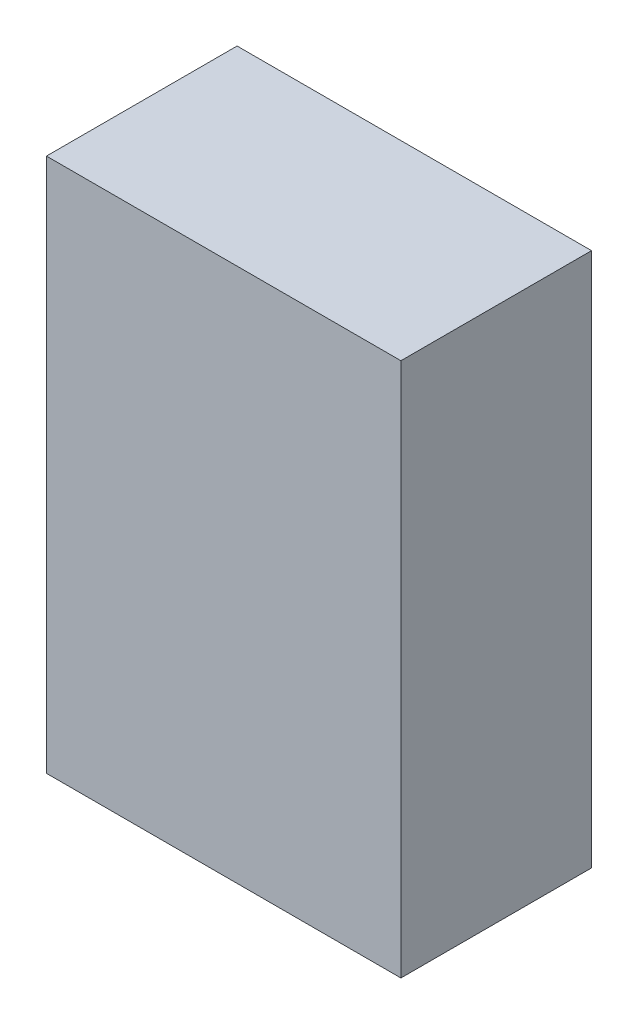
from build123d import *

# Parameters (mm, degrees)
SKETCH1_W               = 1.8593
SKETCH1_H               = 2.8042
COMPONENT_OUTLINE_DEPTH = 1


with BuildPart() as part:
    # Sketch1 → Component_Outline (new body)
    with BuildSketch(Plane.XY):
        with Locations((0.92965, 1.4021)):
            Rectangle(SKETCH1_W, SKETCH1_H)
    extrude(amount=COMPONENT_OUTLINE_DEPTH)


solid = part.part
